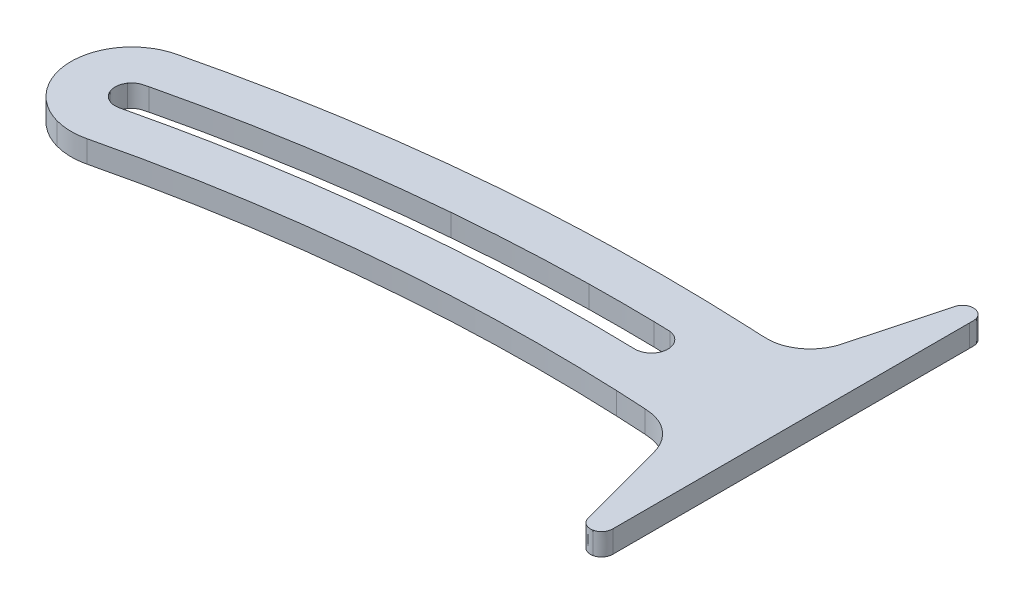
from build123d import *

# Parameters (mm, degrees)
BOSS_EXTRUDE1_DEPTH = 6.35


with BuildPart() as part:
    # Imported Profile → Boss-Extrude1 (new body)
    with BuildSketch(Plane(origin=(0, 0, 0), x_dir=(1, 0, 0), z_dir=(0, 1, 0))):
        with BuildLine():
            add(Edge.make_bspline(
                [(12.8991106, 25.2359922), (15.9171132, 24.409273), (18.70075, 24.3472716), (21.7531188, 25.0501404)],
                knots=[0, 0, 0, 0, 1, 1, 1, 1], degree=3))
            add(Edge.make_bspline(
                [(21.7531188, 25.0501404), (67.2421566, 35.9573322), (114.0334524, 40.4772876), (160.7696048, 38.492938)],
                knots=[0, 0, 0, 0, 1, 1, 1, 1], degree=3))
            add(Edge.make_bspline(
                [(160.7696048, 38.492938), (163.6634776, 38.3689352), (166.5573758, 38.2174242), (169.4443652, 38.0449328)],
                knots=[0, 0, 0, 0, 1, 1, 1, 1], degree=3))
            add(Edge.make_bspline(
                [(169.4443652, 38.0449328), (172.5862944, 37.8589286), (175.108108, 37.0734336), (177.5541026, 34.9719392)],
                knots=[0, 0, 0, 0, 1, 1, 1, 1], degree=3))
            add(Edge.make_bspline(
                [(177.5541026, 34.9719392), (178.725449, 33.9728302), (179.6418556, 32.842835), (180.3928574, 31.4992766)],
                knots=[0, 0, 0, 0, 1, 1, 1, 1], degree=3))
            add(Edge.make_bspline(
                [(180.3928574, 31.4992766), (181.1025588, 30.2176688), (181.4952936, 28.8603182), (181.8673782, 27.4684744)],
                knots=[0, 0, 0, 0, 1, 1, 1, 1], degree=3))
            add(Edge.make_bspline(
                [(181.8673782, 27.4684744), (182.6184054, 24.6641874), (183.3694326, 21.859875), (184.1204598, 19.0624714)],
                knots=[0, 0, 0, 0, 1, 1, 1, 1], degree=3))
            add(Edge.make_bspline(
                [(184.1204598, 19.0624714), (184.871487, 16.2581844), (185.6225142, 13.453872), (186.3735414, 10.6495342)],
                knots=[0, 0, 0, 0, 1, 1, 1, 1], degree=3))
            add(Edge.make_bspline(
                [(186.3735414, 10.6495342), (186.7456514, 9.2508324), (187.1245686, 7.8521306), (187.4966532, 6.44652)],
                knots=[0, 0, 0, 0, 1, 1, 1, 1], degree=3))
            add(Edge.make_bspline(
                [(187.4966532, 6.44652), (187.6827082, 5.7506362), (187.8755958, 5.0478182), (188.0616508, 4.3450256)],
                knots=[0, 0, 0, 0, 1, 1, 1, 1], degree=3))
            add(Edge.make_bspline(
                [(188.0616508, 4.3450256), (188.2477058, 3.649091), (188.378592, 2.9463238), (188.6335318, 2.2641814)],
                knots=[0, 0, 0, 0, 1, 1, 1, 1], degree=3))
            add(Edge.make_bspline(
                [(188.6335318, 2.2641814), (189.1847372, 0.8172196), (190.7005838, -0.0164592), (192.2233138, 0.2798318)],
                knots=[0, 0, 0, 0, 1, 1, 1, 1], degree=3))
            add(Edge.make_bspline(
                [(192.2233138, 0.2798318), (193.787395, 0.5968238), (194.7795952, 1.9334734), (194.7795952, 3.4975292)],
                knots=[0, 0, 0, 0, 1, 1, 1, 1], degree=3))
            add(Edge.make_bspline(
                [(194.7795952, 3.4975292), (194.7795952, 6.3982854), (194.7795952, 9.2990924), (194.7795952, 12.1998232)],
                knots=[0, 0, 0, 0, 1, 1, 1, 1], degree=3))
            add(Edge.make_bspline(
                [(194.7795952, 12.1998232), (194.7795952, 35.5506782), (194.7795952, 58.908442), (194.7795952, 82.2592716)],
                knots=[0, 0, 0, 0, 1, 1, 1, 1], degree=3))
            add(Edge.make_bspline(
                [(194.7795952, 82.2592716), (194.7795952, 88.0608348), (194.7795952, 93.8623726), (194.7795952, 99.6708192)],
                knots=[0, 0, 0, 0, 1, 1, 1, 1], degree=3))
            add(Edge.make_bspline(
                [(194.7795952, 99.6708192), (194.7795952, 101.117781), (194.7795952, 102.5715754), (194.7795952, 104.0185372)],
                knots=[0, 0, 0, 0, 1, 1, 1, 1], degree=3))
            add(Edge.make_bspline(
                [(194.7795952, 104.0185372), (194.7795952, 104.74198), (194.7795952, 105.4723824), (194.7795952, 106.1958252)],
                knots=[0, 0, 0, 0, 1, 1, 1, 1], degree=3))
            add(Edge.make_bspline(
                [(194.7795952, 106.1958252), (194.7795952, 106.919268), (194.8485308, 107.6151772), (194.6072308, 108.3386708)],
                knots=[0, 0, 0, 0, 1, 1, 1, 1], degree=3))
            add(Edge.make_bspline(
                [(194.6072308, 108.3386708), (194.10426, 109.799374), (192.6228558, 110.6882216), (191.0932424, 110.4401906)],
                knots=[0, 0, 0, 0, 1, 1, 1, 1], degree=3))
            add(Edge.make_bspline(
                [(191.0932424, 110.4401906), (190.2595382, 110.302675), (189.6807484, 109.9716876), (189.1433352, 109.3170788)],
                knots=[0, 0, 0, 0, 1, 1, 1, 1], degree=3))
            add(Edge.make_bspline(
                [(189.1433352, 109.3170788), (188.6541312, 108.7176388), (188.5094274, 108.0423798), (188.3233724, 107.3326784)],
                knots=[0, 0, 0, 0, 1, 1, 1, 1], degree=3))
            add(Edge.make_bspline(
                [(188.3233724, 107.3326784), (186.821318, 101.7309878), (185.3192636, 96.129221), (183.8172092, 90.5206216)],
                knots=[0, 0, 0, 0, 1, 1, 1, 1], degree=3))
            add(Edge.make_bspline(
                [(183.8172092, 90.5206216), (183.0661566, 87.723218), (182.390923, 84.9120222), (181.5641022, 82.1352688)],
                knots=[0, 0, 0, 0, 1, 1, 1, 1], degree=3))
            add(Edge.make_bspline(
                [(181.5641022, 82.1352688), (180.7097224, 79.2482794), (178.8562844, 76.7678424), (176.3413288, 75.1210334)],
                knots=[0, 0, 0, 0, 1, 1, 1, 1], degree=3))
            add(Edge.make_bspline(
                [(176.3413288, 75.1210334), (172.248576, 72.4476834), (169.1410892, 73.0677736), (164.7796044, 73.26757)],
                knots=[0, 0, 0, 0, 1, 1, 1, 1], degree=3))
            add(Edge.make_bspline(
                [(164.7796044, 73.26757), (145.390616, 74.1908854), (126.0842792, 74.128884), (106.7021742, 73.0125794)],
                knots=[0, 0, 0, 0, 1, 1, 1, 1], degree=3))
            add(Edge.make_bspline(
                [(106.7021742, 73.0125794), (83.2893178, 71.6620868), (60.2485206, 68.6924204), (37.2421658, 64.1724396)],
                knots=[0, 0, 0, 0, 1, 1, 1, 1], degree=3))
            add(Edge.make_bspline(
                [(37.2421658, 64.1724396), (29.3115492, 62.6152926), (21.4154004, 60.9064822), (13.553694, 58.9979262)],
                knots=[0, 0, 0, 0, 1, 1, 1, 1], degree=3))
            add(Edge.make_bspline(
                [(13.553694, 58.9979262), (13.4434326, 58.9679288), (13.3331966, 58.9429352), (13.229844, 58.915427)],
                knots=[0, 0, 0, 0, 1, 1, 1, 1], degree=3))
            add(Edge.make_bspline(
                [(13.229844, 58.915427), (13.0093466, 58.860436), (12.7889, 58.7984346), (12.575286, 58.7294228)],
                knots=[0, 0, 0, 0, 1, 1, 1, 1], degree=3))
            add(Edge.make_bspline(
                [(12.575286, 58.7294228), (12.1274332, 58.5914246), (11.6933218, 58.446924), (11.2661446, 58.2744326)],
                knots=[0, 0, 0, 0, 1, 1, 1, 1], degree=3))
            add(Edge.make_bspline(
                [(11.2661446, 58.2744326), (10.377297, 57.922922), (9.5298006, 57.5027298), (8.7098886, 57.0135258)],
                knots=[0, 0, 0, 0, 1, 1, 1, 1], degree=3))
            add(Edge.make_bspline(
                [(8.7098886, 57.0135258), (6.9735446, 55.9731418), (5.5197248, 54.7259764), (4.231259, 53.1688294)],
                knots=[0, 0, 0, 0, 1, 1, 1, 1], degree=3))
            add(Edge.make_bspline(
                [(4.231259, 53.1688294), (1.7438878, 50.1715786), (0.3383026, 46.4302348), (0.2280666, 42.5372784)],
                knots=[0, 0, 0, 0, 1, 1, 1, 1], degree=3))
            add(Edge.make_bspline(
                [(0.2280666, 42.5372784), (-0.0061976, 34.5515184), (5.2165504, 27.4270724), (12.8991106, 25.2359922)],
                knots=[0, 0, 0, 0, 1, 1, 1, 1], degree=3))
        make_face()
        with BuildLine():
            add(Edge.make_bspline(
                [(153.0043676, 51.4684772), (156.490797, 51.3705856), (158.8885824, 54.9190926), (157.5036474, 58.1161398)],
                knots=[0, 0, 0, 0, 1, 1, 1, 1], degree=3))
            add(Edge.make_bspline(
                [(157.5036474, 58.1161398), (156.8352972, 59.65952), (155.4090364, 60.7343718), (153.7416026, 60.9479858)],
                knots=[0, 0, 0, 0, 1, 1, 1, 1], degree=3))
            add(Edge.make_bspline(
                [(153.7416026, 60.9479858), (153.2937498, 61.0099872), (149.5385884, 61.0719886), (149.0907356, 61.0789736)],
                knots=[0, 0, 0, 0, 1, 1, 1, 1], degree=3))
            add(Edge.make_bspline(
                [(149.0907356, 61.0789736), (142.848203, 61.1959914), (136.5988124, 61.2029764), (130.3494218, 61.093985)],
                knots=[0, 0, 0, 0, 1, 1, 1, 1], degree=3))
            add(Edge.make_bspline(
                [(130.3494218, 61.093985), (117.7059114, 60.8804726), (105.1106356, 60.2120208), (92.5153598, 59.0889344)],
                knots=[0, 0, 0, 0, 1, 1, 1, 1], degree=3))
            add(Edge.make_bspline(
                [(92.5153598, 59.0889344), (67.2421566, 56.8358274), (42.458132, 52.805076), (17.7705766, 46.9484202)],
                knots=[0, 0, 0, 0, 1, 1, 1, 1], degree=3))
            add(Edge.make_bspline(
                [(17.7705766, 46.9484202), (16.1651696, 46.5694268), (14.7733512, 46.2387188), (13.7329418, 44.6953386)],
                knots=[0, 0, 0, 0, 1, 1, 1, 1], degree=3))
            add(Edge.make_bspline(
                [(13.7329418, 44.6953386), (12.8234186, 43.3517294), (12.664948, 41.6498786), (13.3057392, 40.1546822)],
                knots=[0, 0, 0, 0, 1, 1, 1, 1], degree=3))
            add(Edge.make_bspline(
                [(13.3057392, 40.1546822), (13.9671806, 38.6043678), (15.4072336, 37.5226326), (17.0815508, 37.3090186)],
                knots=[0, 0, 0, 0, 1, 1, 1, 1], degree=3))
            add(Edge.make_bspline(
                [(17.0815508, 37.3090186), (17.8808126, 37.205539), (18.6111896, 37.3590312), (19.3691002, 37.5365264)],
                knots=[0, 0, 0, 0, 1, 1, 1, 1], degree=3))
            add(Edge.make_bspline(
                [(19.3691002, 37.5365264), (20.1270108, 37.7225306), (20.8849468, 37.9015244), (21.6428574, 38.0739904)],
                knots=[0, 0, 0, 0, 1, 1, 1, 1], degree=3))
            add(Edge.make_bspline(
                [(21.6428574, 38.0739904), (27.726894, 39.5002258), (33.8316062, 40.8093926), (39.9707608, 42.0151306)],
                knots=[0, 0, 0, 0, 1, 1, 1, 1], degree=3))
            add(Edge.make_bspline(
                [(39.9707608, 42.0151306), (52.380007, 44.440475), (64.8374624, 46.4110832), (77.3914124, 47.9269298)],
                knots=[0, 0, 0, 0, 1, 1, 1, 1], degree=3))
            add(Edge.make_bspline(
                [(77.3914124, 47.9269298), (102.5750552, 50.965481), (127.648462, 52.1368274), (153.0043676, 51.4684772)],
                knots=[0, 0, 0, 0, 1, 1, 1, 1], degree=3))
        make_face(mode=Mode.SUBTRACT)
    extrude(amount=BOSS_EXTRUDE1_DEPTH)


solid = part.part
